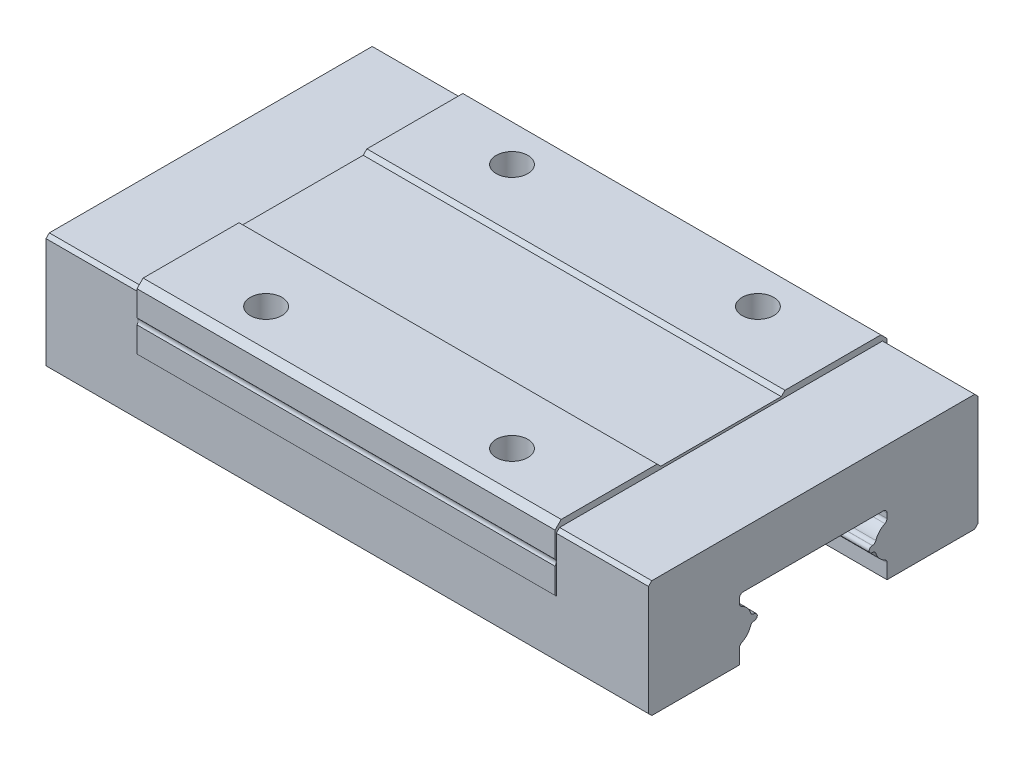
from build123d import *

# Parameters (mm, degrees)
EXTRUDE_1_DEPTH        = 49
SKETCH_2_W             = 34
SKETCH_2_H             = 4.7
EXTRUDE_2_DEPTH        = 0.1
SKETCH_3_W             = 34
SKETCH_3_H             = 4.6
EXTRUDE_3_DEPTH        = 0.1
SKETCH_4_W             = 34
SKETCH_4_H             = 27
EXTRUDE_4_DEPTH        = 0.5
CUT_EXTRUDE_1_DEPTH    = 34
SKETCH_6_W             = 9.8
SKETCH_6_H             = 0.3
CUT_EXTRUDE_2_DEPTH    = 45.558949718
DRAFT_1_ANGLE          = 45
DRAFT_2_ANGLE          = 45
DRAFT_3_ANGLE          = 45
HOLE_WIZARD_M2_1_D     = 2.58
HOLE_WIZARD_M2_1_DEPTH = 3.5
HOLE_WIZARD_M2_1_TIP   = 0.775110199
CHAMFER_1_SIZE         = 0.27
CHAMFER_2_SIZE         = 0.5
FILLET_1_R             = 0.3


with BuildPart() as part:
    # 草图1 → 凸台-拉伸1 (new body)
    with BuildSketch(Plane(origin=(-24.5, 0, 0), x_dir=(0, -1, 0), z_dir=(-1, 0, 0))):
        with BuildLine():
            Line((1, 13.4), (-8.5, 13.4))
            Line((-8.5, 13.4), (-8.5, -13.4))
            Line((-8.5, -13.4), (1, -13.4))
            Line((1, -13.4), (1, -6))
            Line((1, -6), (-0.408889, -6))
            ThreePointArc((-0.408889, -6), (-0.826571316, -5.367595703), (-1.51, -5.04))
            Line((-1.51, -5.04), (-1.51, -4.8))
            ThreePointArc((-1.51, -4.8), (-1.76, -4.55), (-2.01, -4.8))
            Line((-2.01, -4.8), (-2.01, -5.04))
            ThreePointArc((-2.01, -5.04), (-2.693428684, -5.367595703), (-3.111111, -6))
            Line((-3.111111, -6), (-4, -6))
            Line((-4, -6), (-4, 6))
            Line((-4, 6), (-3.111111, 6))
            ThreePointArc((-3.111111, 6), (-2.693428684, 5.367595703), (-2.01, 5.04))
            Line((-2.01, 5.04), (-2.01, 4.8))
            ThreePointArc((-2.01, 4.8), (-1.76, 4.55), (-1.51, 4.8))
            Line((-1.51, 4.8), (-1.51, 5.04))
            ThreePointArc((-1.51, 5.04), (-0.826571316, 5.367595703), (-0.408889, 6))
            Line((-0.408889, 6), (1, 6))
            Line((1, 6), (1, 13.4))
        make_face()
    extrude(amount=-EXTRUDE_1_DEPTH)

    # 草图2 → 凸台-拉伸2 (add)
    with BuildSketch(Plane(origin=(0, 0, -13.4), x_dir=(-1, 0, 0), z_dir=(0, 0, -1))):
        with Locations((0, 6.15)):
            Rectangle(SKETCH_2_W, SKETCH_2_H)
    extrude(amount=EXTRUDE_2_DEPTH)

    # 草图3 → 凸台-拉伸3 (add)
    with BuildSketch(Plane.XY.offset(13.4)):
        with Locations((0, 6.2)):
            Rectangle(SKETCH_3_W, SKETCH_3_H)
    extrude(amount=EXTRUDE_3_DEPTH)

    # 草图4 → 凸台-拉伸4 (add)
    with BuildSketch(Plane(origin=(0, 8.5, 0), x_dir=(-1, 0, 0), z_dir=(0, 1, 0))):
        Rectangle(SKETCH_4_W, SKETCH_4_H)
    extrude(amount=EXTRUDE_4_DEPTH)

    # 草图5 → 切除-拉伸1 (cut)
    with BuildSketch(Plane(origin=(17, 0, 0), x_dir=(0, 0, -1), z_dir=(1, 0, 0))):
        with BuildLine():
            Line((-13.5, 6.444948974), (-13.5, 5.955051026))
            ThreePointArc((-13.5, 5.955051026), (-13.4, 6.2), (-13.5, 6.444948974))
        make_face()
    extrude(amount=-CUT_EXTRUDE_1_DEPTH, mode=Mode.SUBTRACT)

    # 草图6 → 切除-拉伸2 (cut, through all)
    with BuildSketch(Plane(origin=(17, 0, 0), x_dir=(0, 0, -1), z_dir=(1, 0, 0))):
        with Locations((0, 8.85)):
            Rectangle(SKETCH_6_W, SKETCH_6_H)
    extrude(amount=-CUT_EXTRUDE_2_DEPTH, mode=Mode.SUBTRACT)

    # 拔模1
    draft_1_faces = [part.faces().sort_by_distance(p)[0] for p in [
        (0, 3.9, 13.45),
    ]]
    draft(draft_1_faces, Plane.XY.offset(13.5), DRAFT_1_ANGLE)

    # 拔模2
    draft_2_faces = [part.faces().sort_by_distance(p)[0] for p in [
        (0, 3.8, -13.45),
    ]]
    draft(draft_2_faces, Plane(origin=(24.5, 8.5, -13.4), x_dir=(-1, 0, 0), z_dir=(0, 0, -1)), DRAFT_2_ANGLE)

    # 拔模3
    draft_3_faces = [part.faces().sort_by_distance(p)[0] for p in [
        (0, 8.85, 4.9),
        (0, 8.85, -4.9),
    ]]
    draft(draft_3_faces, Plane(origin=(-24.5, 8.7, 4.9), x_dir=(0, 0, 1), z_dir=(0, 1, 0)), DRAFT_3_ANGLE)

    # M2 间隙孔1
    with Locations(Plane(origin=(0, 9, 0), x_dir=(1, 0, 0), z_dir=(0, 1, 0))):
        with Locations((10, -10), (-10, -10), (-10, 10), (10, 10)):
            Hole(HOLE_WIZARD_M2_1_D / 2, depth=HOLE_WIZARD_M2_1_DEPTH)
            with Locations((0, 0, -(HOLE_WIZARD_M2_1_DEPTH + HOLE_WIZARD_M2_1_TIP / 2))):  # 118° drill point
                Cone(0, HOLE_WIZARD_M2_1_D / 2, HOLE_WIZARD_M2_1_TIP, mode=Mode.SUBTRACT)

    # 倒角1
    chamfer_1_edges = [part.edges().sort_by_distance(p)[0] for p in [
        (0, -1, -13.4),
        (20.75, 8.5, -13.4),
        (20.75, 8.5, 13.4),
        (0, -1, 13.4),
        (-20.75, 8.5, -13.4),
        (-20.75, 8.5, 13.4),
    ]]
    chamfer(chamfer_1_edges, length=CHAMFER_1_SIZE)

    # 倒角2
    chamfer_2_edges = [part.edges().sort_by_distance(p)[0] for p in [
        (0, 9, 13.5),
        (0, 9, -13.5),
    ]]
    chamfer(chamfer_2_edges, length=CHAMFER_2_SIZE)

    # 圆角1
    fillet_1_edges = [part.edges().sort_by_distance(p)[0] for p in [
        (0, 0.408889, 6),
        (0, 1.51, 5.04),
        (0, 2.01, 5.04),
        (0, 3.111111, 6),
        (0, 4, 6),
        (0, 4, -6),
        (0, 3.111111, -6),
        (0, 2.01, -5.04),
        (0, 1.51, -5.04),
        (0, 0.408889, -6),
    ]]
    fillet(fillet_1_edges, radius=FILLET_1_R)


solid = part.part
